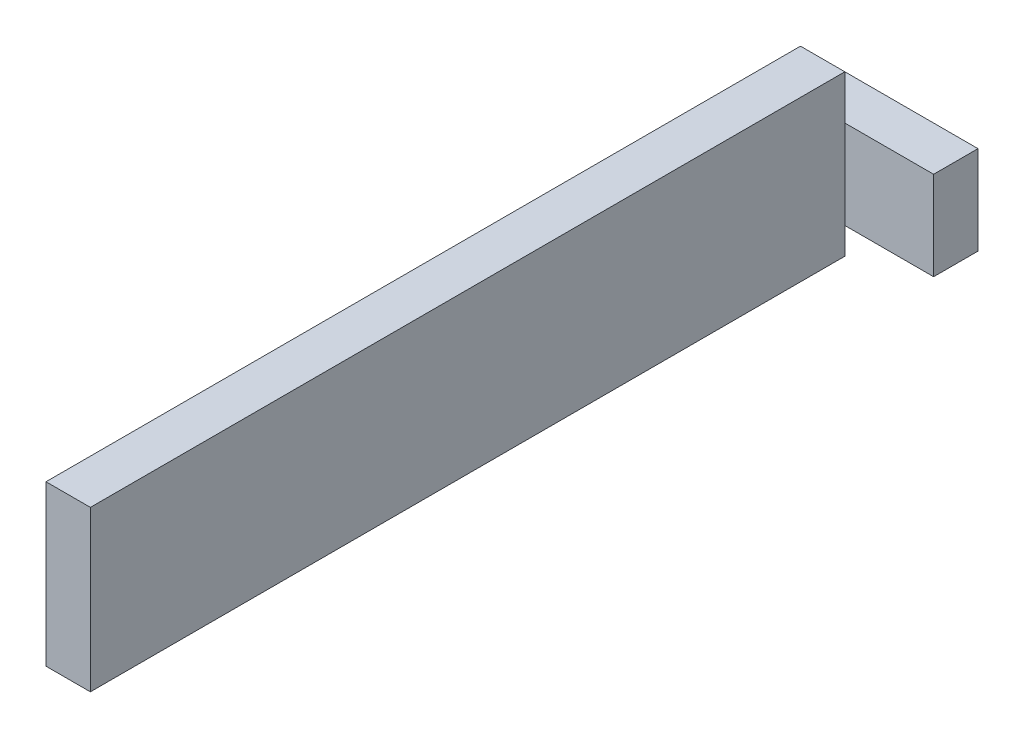
from build123d import *

# Parameters (mm, degrees)
BOSS_EXTRUDE1_DEPTH = 10
SKETCH3_W           = 5
SKETCH3_H           = 85
BOSS_EXTRUDE2_DEPTH = 5
SKETCH5_W           = 5
SKETCH5_H           = 85
BOSS_EXTRUDE4_DEPTH = 3


with BuildPart() as part:
    # Sketch1 → Boss-Extrude1 (new body)
    with BuildSketch(Plane(origin=(0, 0, 0), x_dir=(1, 0, 0), z_dir=(0, 1, 0))):
        Polygon((0, 0), (-10, 0), (-10, -90), (-5, -90), (-5, -5), (0, -5), (5, -5), (5, 0), align=None)
    extrude(amount=BOSS_EXTRUDE1_DEPTH)

    # Sketch3 → Boss-Extrude2 (add)
    with BuildSketch(Plane(origin=(0, 10, 0), x_dir=(1, 0, 0), z_dir=(0, 1, 0))):
        with Locations((-7.5, -47.5)):
            Rectangle(SKETCH3_W, SKETCH3_H)
    extrude(amount=BOSS_EXTRUDE2_DEPTH)

    # Sketch5 → Boss-Extrude4 (add)
    with BuildSketch(Plane(origin=(0, 0, 0), x_dir=(-1, 0, 0), z_dir=(0, -1, 0))):
        with Locations((7.5, -47.5)):
            Rectangle(SKETCH5_W, SKETCH5_H)
    extrude(amount=BOSS_EXTRUDE4_DEPTH)


solid = part.part
